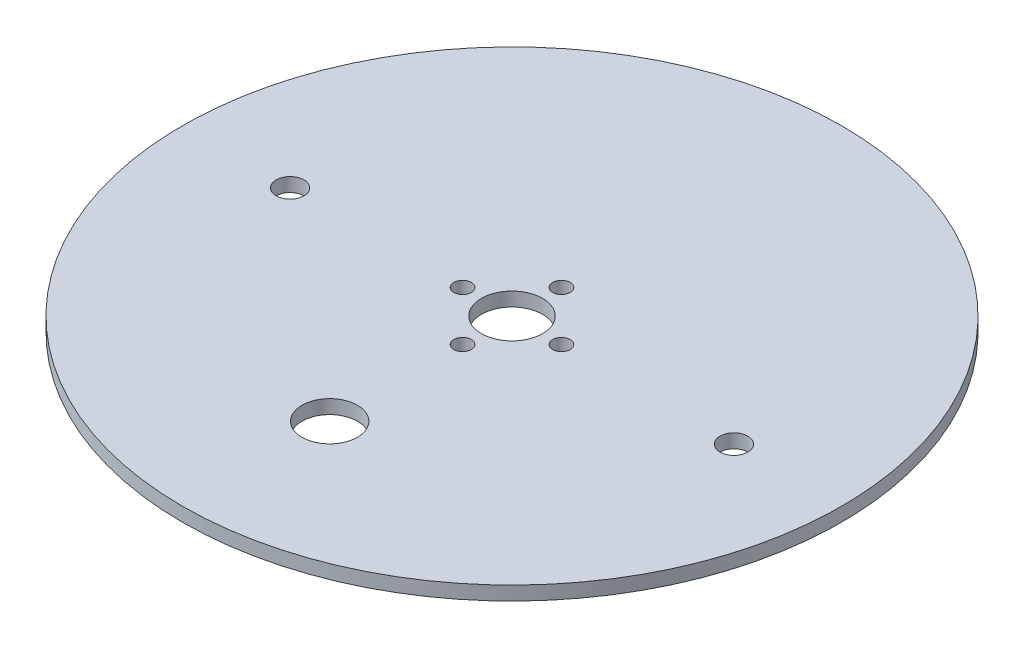
from build123d import *

# Parameters (mm, degrees)
SKETCH1_R                  = 75.438
BOSS_EXTRUDE1_DEPTH        = 3.175
SKETCH2_R                  = 3.175
CUT_EXTRUDE1_DEPTH         = 107.732676875
SKETCH3_R                  = 7
SKETCH3_R_2                = 2
CUT_EXTRUDE2_DEPTH         = 107.732676875
F_1_2_0_5_DIAMETER_HOLE1_D = 12.7


with BuildPart() as part:
    # Sketch1 → Boss-Extrude1 (new body)
    with BuildSketch(Plane(origin=(0, 0, 0), x_dir=(1, 0, 0), z_dir=(0, 1, 0))):
        with Locations(Location((0, 0, 0), (0, 0, 270))):
            Circle(SKETCH1_R)
    extrude(amount=BOSS_EXTRUDE1_DEPTH)

    # Sketch2 → Cut-Extrude1 (cut, through all)
    with BuildSketch(Plane(origin=(0, 3.175, 0), x_dir=(1, 0, 0), z_dir=(0, 1, 0))):
        with Locations(Location((50.8, 0, 0), (0, 0, 270))):
            Circle(SKETCH2_R)
        with Locations(Location((-50.8, 0, 0), (0, 0, 90))):
            Circle(SKETCH2_R)
    extrude(amount=-CUT_EXTRUDE1_DEPTH, mode=Mode.SUBTRACT)

    # Sketch3 → Cut-Extrude2 (cut, through all)
    with BuildSketch(Plane(origin=(0, 3.175, 0), x_dir=(1, 0, 0), z_dir=(0, 1, 0))):
        with Locations(Location((0, 0, 0), (0, 0, 270))):
            Circle(SKETCH3_R)
        with Locations(Location((0, -11.314, 0), (0, 0, 270))):
            Circle(SKETCH3_R_2)
        with Locations(Location((-11.314, 0, 0), (0, 0, 270))):
            Circle(SKETCH3_R_2)
        with Locations(Location((11.314, 0, 0), (0, 0, 270))):
            Circle(SKETCH3_R_2)
        with Locations(Location((0, 11.314, 0), (0, 0, 270))):
            Circle(SKETCH3_R_2)
    extrude(amount=-CUT_EXTRUDE2_DEPTH, mode=Mode.SUBTRACT)

    # 1/2 (0.5) Diameter Hole1 (through all)
    with Locations(Plane(origin=(0, 3.175, 0), x_dir=(1, 0, 0), z_dir=(0, 1, 0))):
        with Locations((0, -41.73382544)):
            Hole(F_1_2_0_5_DIAMETER_HOLE1_D / 2)


solid = part.part
